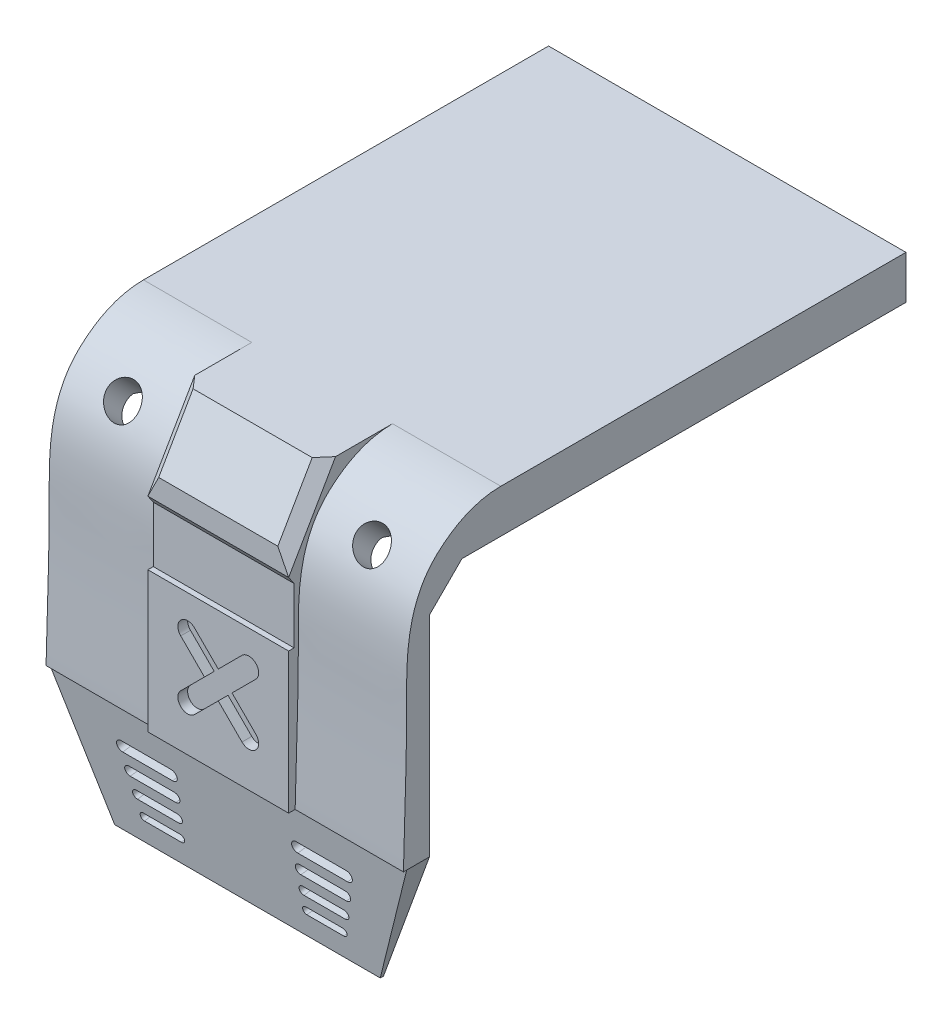
from build123d import *

# Parameters (mm, degrees)
SKETCH_1_W                = 33
SKETCH_1_H                = 24
EXTRUDE_1_DEPTH           = 38
SKETCH_2_W                = 21
SKETCH_2_H                = 33
CUT_EXTRUDE_1_DEPTH       = 35
CHAMFER_1_SIZE            = 5.5
CHAMFER_1_SIZE2           = 3.175426481
CHAMFER_2_SIZE            = 2
CHAMFER_3_SIZE            = 1
CUT_EXTRUDE_2_DEPTH       = 35
CUT_EXTRUDE_3_DEPTH       = 10
CUT_EXTRUDE_4_DEPTH       = 47.446205605
EXTRUDE_4_DEPTH           = 23
CHAMFER_4_SIZE            = 1
CUT_EXTRUDE_5_DEPTH       = 62.385572206
CUT_EXTRUDE_6_DEPTH       = 0.9
CUT_EXTRUDE_10_DEPTH      = 57.550862232
CUT_EXTRUDE_11_DEPTH      = 61.805016358
CUT_EXTRUDE_11_DEPTH_BACK = 61.805016358
SKETCH_11_R               = 1.55


with BuildPart() as part:
    # 草图1 → 凸台-拉伸1 (new body)
    with BuildSketch(Plane(origin=(0, 0, 0), x_dir=(1, 0, 0), z_dir=(0, 1, 0))):
        Rectangle(SKETCH_1_W, SKETCH_1_H)
    extrude(amount=EXTRUDE_1_DEPTH)

    # 草图2 → 切除-拉伸1 (cut)
    with BuildSketch(Plane.ZY.offset(16.5)):
        with Locations((-1.5, 16.5)):
            Rectangle(SKETCH_2_W, SKETCH_2_H)
    extrude(amount=-CUT_EXTRUDE_1_DEPTH, mode=Mode.SUBTRACT)

    # 倒角1
    chamfer_1_edges = [part.edges().sort_by_distance(p)[0] for p in [
        (0, 38, 12),
    ]]
    chamfer_1_side = [part.faces().sort_by_distance(p)[0] for p in [
        (0, 19, 12),
    ]]
    chamfer(chamfer_1_edges, length=CHAMFER_1_SIZE, length2=CHAMFER_1_SIZE2, reference=chamfer_1_side[0])

    # 倒角2
    chamfer_2_edges = [part.edges().sort_by_distance(p)[0] for p in [
        (0, 33, 9),
    ]]
    chamfer(chamfer_2_edges, length=CHAMFER_2_SIZE)

    # 倒角3
    chamfer_3_edges = [part.edges().sort_by_distance(p)[0] for p in [
        (-16.5, 33, -2.5),
        (16.5, 33, -2.5),
    ]]
    chamfer(chamfer_3_edges, length=CHAMFER_3_SIZE)

    # 草图3 → 切除-拉伸2 (cut)
    with BuildSketch(Plane.ZY.offset(16.5)):
        Polygon((12, 11.65264418), (11.1, 11.65264418), (9.3, 0), (12, 0), align=None)
    extrude(amount=-CUT_EXTRUDE_2_DEPTH, mode=Mode.SUBTRACT)

    # 草图4 → 切除-拉伸3 (cut)
    with BuildSketch(Plane.ZY.offset(16.5)):
        with BuildLine():
            Line((2.407420419, 38), (8.824573519, 38))
            Line((8.824573519, 38), (12, 32.5))
            Line((12, 32.5), (12, 11.65264418))
            Line((12, 11.65264418), (11.4, 11.65264418))
            add(Edge.make_bspline(
                [(2.407420419, 38), (4.944551671, 38), (7.556679946, 36.344258823), (10.730064424, 32.982057859), (11.149753025, 28.468325596), (11.041432106, 20.888283621), (11.4, 13.338591536), (11.4, 11.65264418)],
                knots=[0, 0, 0, 0, 0.112889984, 0.156477463, 0.404830641, 0.492287309, 1, 1, 1, 1], degree=3))
        make_face()
    cut_extrude_3 = extrude(amount=-CUT_EXTRUDE_3_DEPTH, mode=Mode.SUBTRACT)

    # 镜向1: 切除-拉伸3 across plane
    add(cut_extrude_3.mirror(Plane(origin=(0, 0, 0), x_dir=(0, 0, 1), z_dir=(1, 0, 0))), mode=Mode.SUBTRACT)

    # 草图6 → 切除-拉伸4 (cut, through all)
    with BuildSketch(Plane(origin=(0, 0, 9), x_dir=(-1, 0, 0), z_dir=(0, 0, -1))):
        Polygon((16.5, 11.65264418), (12.258784368, 0), (16.5, 0), align=None)
        Polygon((-12.258784368, 0), (-16.5, 0), (-16.5, 11.65264418), align=None)
    extrude(amount=-CUT_EXTRUDE_4_DEPTH, mode=Mode.SUBTRACT)

    # 草图8 → 凸台-拉伸4 (add)
    with BuildSketch(Plane(origin=(0, 0, -12), x_dir=(-1, 0, 0), z_dir=(0, 0, -1))):
        Polygon((-16.5, 38), (-16.5, 34), (-15.5, 33), (15.5, 33), (16.5, 34), (16.5, 38), align=None)
    extrude(amount=EXTRUDE_4_DEPTH)

    # 倒角4
    chamfer_4_edges = [part.edges().sort_by_distance(p)[0] for p in [
        (6.5, 35.25, 10.41228676),
        (-6.5, 35.25, 10.41228676),
    ]]
    chamfer(chamfer_4_edges, length=CHAMFER_4_SIZE)

    # 草图9 → 切除-拉伸5 (cut, through all)
    with BuildSketch(Plane(origin=(0, -1.403103783, 9.083260626), x_dir=(1, 0, 0), z_dir=(0, -0.15266076466219888, 0.9882786504487248))):
        with BuildLine():
            Line((-10.383328506, 9.819745111), (-5.783328506, 9.819745111))
            ThreePointArc((-5.783328506, 9.819745111), (-5.283328506, 9.319745111), (-5.783328506, 8.819745111))
            Line((-5.783328506, 8.819745111), (-10.383328506, 8.819745111))
            ThreePointArc((-10.383328506, 8.819745111), (-10.883328506, 9.319745111), (-10.383328506, 9.819745111))
        make_face()
        with BuildLine():
            Line((-9.978375247, 7.819745111), (-5.778375247, 7.819745111))
            ThreePointArc((-5.778375247, 7.819745111), (-5.328375247, 7.369745111), (-5.778375247, 6.919745111))
            Line((-5.778375247, 6.919745111), (-9.978375247, 6.919745111))
            ThreePointArc((-9.978375247, 6.919745111), (-10.428375247, 7.369745111), (-9.978375247, 7.819745111))
        make_face()
        with BuildLine():
            Line((-9.583932412, 5.919745111), (-5.783932412, 5.919745111))
            ThreePointArc((-5.783932412, 5.919745111), (-5.383932412, 5.519745111), (-5.783932412, 5.119745111))
            Line((-5.783932412, 5.119745111), (-9.583932412, 5.119745111))
            ThreePointArc((-9.583932412, 5.119745111), (-9.983932412, 5.519745111), (-9.583932412, 5.919745111))
        make_face()
        with BuildLine():
            Line((-9.2, 4.119745111), (-5.8, 4.119745111))
            ThreePointArc((-5.8, 4.119745111), (-5.45, 3.769745111), (-5.8, 3.419745111))
            Line((-5.8, 3.419745111), (-9.2, 3.419745111))
            ThreePointArc((-9.2, 3.419745111), (-9.55, 3.769745111), (-9.2, 4.119745111))
        make_face()
        with BuildLine():
            Line((9.2, 4.119745111), (5.8, 4.119745111))
            ThreePointArc((5.8, 4.119745111), (5.45, 3.769745111), (5.8, 3.419745111))
            Line((5.8, 3.419745111), (9.2, 3.419745111))
            ThreePointArc((9.2, 3.419745111), (9.55, 3.769745111), (9.2, 4.119745111))
        make_face()
        with BuildLine():
            Line((9.583932412, 5.919745111), (5.783932412, 5.919745111))
            ThreePointArc((5.783932412, 5.919745111), (5.383932412, 5.519745111), (5.783932412, 5.119745111))
            Line((5.783932412, 5.119745111), (9.583932412, 5.119745111))
            ThreePointArc((9.583932412, 5.119745111), (9.983932412, 5.519745111), (9.583932412, 5.919745111))
        make_face()
        with BuildLine():
            Line((9.978375247, 7.819745111), (5.778375247, 7.819745111))
            ThreePointArc((5.778375247, 7.819745111), (5.328375247, 7.369745111), (5.778375247, 6.919745111))
            Line((5.778375247, 6.919745111), (9.978375247, 6.919745111))
            ThreePointArc((9.978375247, 6.919745111), (10.428375247, 7.369745111), (9.978375247, 7.819745111))
        make_face()
        with BuildLine():
            Line((10.383328506, 9.819745111), (5.783328506, 9.819745111))
            ThreePointArc((5.783328506, 9.819745111), (5.283328506, 9.319745111), (5.783328506, 8.819745111))
            Line((5.783328506, 8.819745111), (10.383328506, 8.819745111))
            ThreePointArc((10.383328506, 8.819745111), (10.883328506, 9.319745111), (10.383328506, 9.819745111))
        make_face()
    extrude(amount=-CUT_EXTRUDE_5_DEPTH, mode=Mode.SUBTRACT)

    # 草图7 → 切除-拉伸6 (cut)
    with BuildSketch(Plane.XY.offset(12)):
        with BuildLine():
            Line((-3.464823228, 20.844675201), (-1.272792206, 18.65264418))
            Line((-1.272792206, 18.65264418), (0, 19.925436386))
            Line((0, 19.925436386), (-2.192031022, 22.117467408))
            ThreePointArc((-2.192031022, 22.117467408), (-3.464823228, 22.117467408), (-3.464823228, 20.844675201))
        make_face()
        with BuildLine():
            Line((2.192031022, 22.117467408), (0, 19.925436386))
            Line((0, 19.925436386), (1.272792206, 18.65264418))
            Line((1.272792206, 18.65264418), (3.464823228, 20.844675201))
            ThreePointArc((3.464823228, 20.844675201), (3.464823228, 22.117467408), (2.192031022, 22.117467408))
        make_face()
        Polygon((0, 19.925436386), (-1.272792206, 18.65264418), (0, 17.379851974), (1.272792206, 18.65264418), align=None)
        with BuildLine():
            Line((1.272792206, 18.65264418), (0, 17.379851974))
            Line((0, 17.379851974), (2.192031022, 15.187820952))
            ThreePointArc((2.192031022, 15.187820952), (3.464823228, 15.187820952), (3.464823228, 16.460613158))
            Line((3.464823228, 16.460613158), (1.272792206, 18.65264418))
        make_face()
        with BuildLine():
            Line((-1.272792206, 18.65264418), (-3.464823228, 16.460613158))
            ThreePointArc((-3.464823228, 16.460613158), (-3.464823228, 15.187820952), (-2.192031022, 15.187820952))
            Line((-2.192031022, 15.187820952), (0, 17.379851974))
            Line((0, 17.379851974), (-1.272792206, 18.65264418))
        make_face()
    extrude(amount=-CUT_EXTRUDE_6_DEPTH, mode=Mode.SUBTRACT)

    # 草图14 → 切除-拉伸10 (cut, through all)
    with BuildSketch(Plane(origin=(6.5, 0, 0), x_dir=(0, 0, -1), z_dir=(1, 0, 0))):
        Polygon((-12, 24.618124987), (-11.498636716, 24.618124987), (-11.498636716, 29.768492853), (-12, 30.5), align=None)
    extrude(amount=-CUT_EXTRUDE_10_DEPTH, mode=Mode.SUBTRACT)

    # 草图11 → 切除-拉伸11 (cut, two sides: drawn at the far end of the back side and taken through both)
    with BuildSketch(Plane(origin=(0, 20, 20), x_dir=(1, 0, 0), z_dir=(0, -0.7071067811865511, -0.707106781186544)).offset(-CUT_EXTRUDE_11_DEPTH_BACK)):
        with Locations(Location((-11.5, -17.667754382, 0), (0, 0, 270))):
            Circle(SKETCH_11_R)
        with Locations(Location((11.5, -17.667754382, 0), (0, 0, 270))):
            Circle(SKETCH_11_R)
    extrude(amount=CUT_EXTRUDE_11_DEPTH + CUT_EXTRUDE_11_DEPTH_BACK, mode=Mode.SUBTRACT)


solid = part.part
